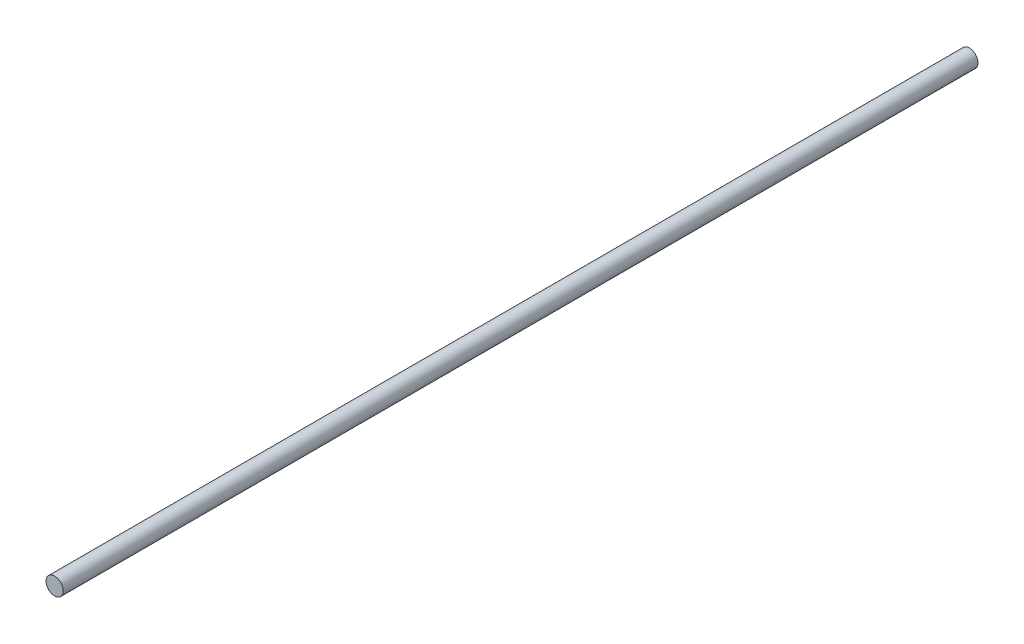
from build123d import *

# Parameters (mm, degrees)
EXTRUDE_1_DEPTH      = 275
EXTRUDE_1_DEPTH_BACK = 150
SKETCH_1_R           = 4


with BuildPart() as part:
    # 草图1 → 凸台-拉伸1 (new, two sides: drawn at the far end of the back side and taken through both)
    with BuildSketch(Plane.XY.offset(-EXTRUDE_1_DEPTH_BACK)):
        Circle(SKETCH_1_R)
    extrude(amount=EXTRUDE_1_DEPTH + EXTRUDE_1_DEPTH_BACK)


solid = part.part
